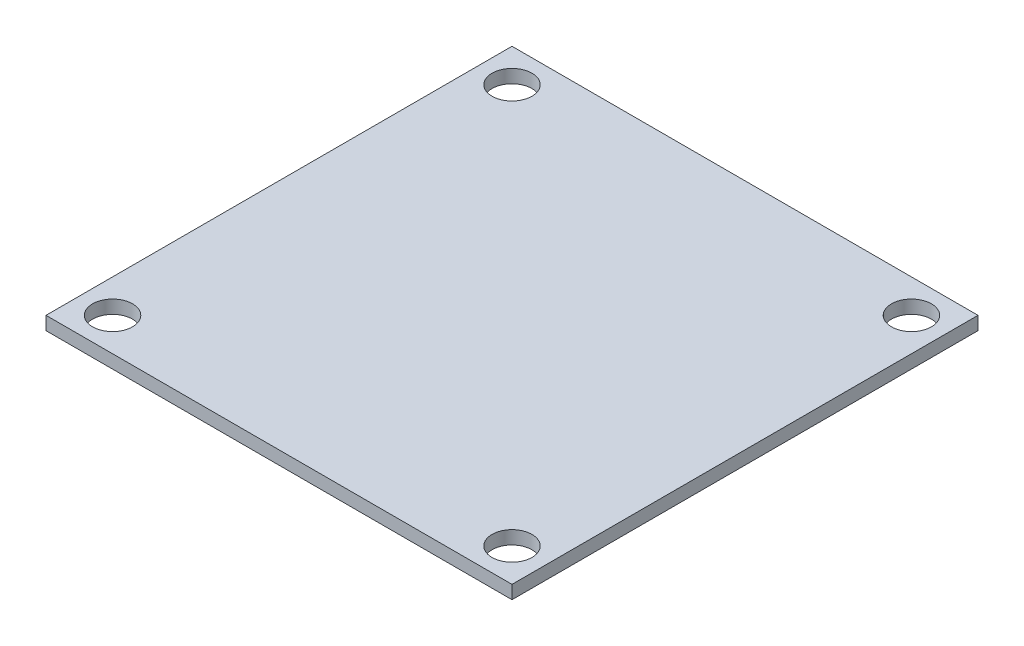
from build123d import *

# Parameters (mm, degrees)
SKETCH_1_W          = 70
SKETCH_1_H          = 70
EXTRUDE_2_DEPTH     = 2
SKETCH_3_R          = 3
CUT_EXTRUDE_1_DEPTH = 50.537864306


with BuildPart() as part:
    # 草图1 → 凸台-拉伸2 (new body)
    with BuildSketch(Plane(origin=(0, 0, 0), x_dir=(1, 0, 0), z_dir=(0, 1, 0))):
        Rectangle(SKETCH_1_W, SKETCH_1_H)
    extrude(amount=EXTRUDE_2_DEPTH)

    # 草图3 → 切除-拉伸1 (cut, through all)
    with BuildSketch(Plane(origin=(0, 2, 0), x_dir=(1, 0, 0), z_dir=(0, 1, 0))):
        with Locations(Location((-30, 30, 0), (0, 0, 270))):
            Circle(SKETCH_3_R)
        with Locations(Location((30, 30, 0), (0, 0, 270))):
            Circle(SKETCH_3_R)
        with Locations(Location((-30, -30, 0), (0, 0, 270))):
            Circle(SKETCH_3_R)
        with Locations(Location((30, -30, 0), (0, 0, 270))):
            Circle(SKETCH_3_R)
    extrude(amount=-CUT_EXTRUDE_1_DEPTH, mode=Mode.SUBTRACT)


solid = part.part
